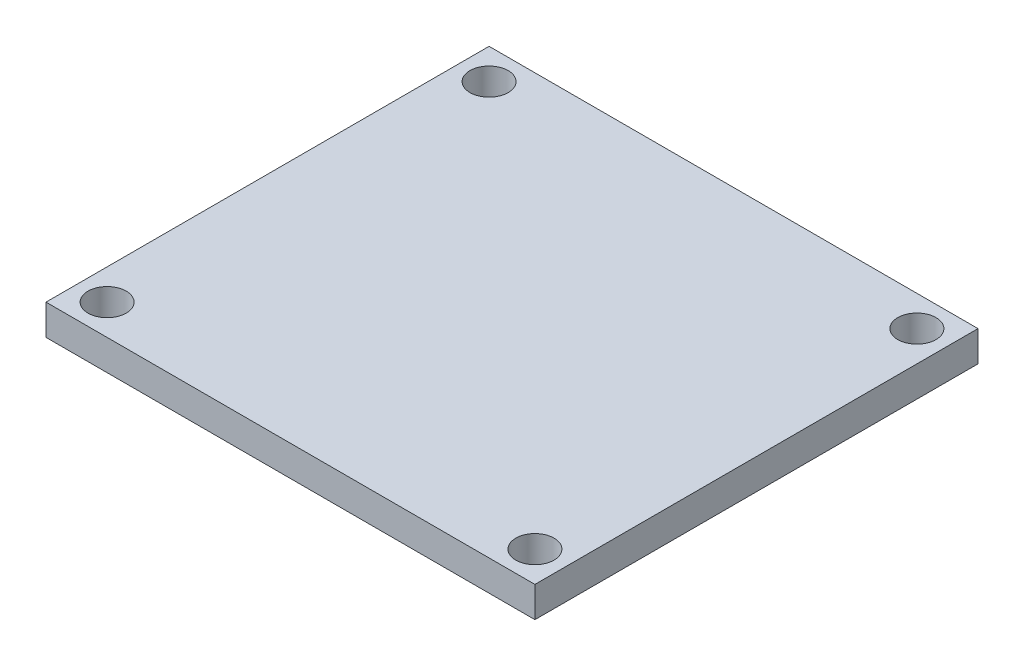
from build123d import *

# Parameters (mm, degrees)
SKETCH1_W           = 40.64
SKETCH1_H           = 36.83
SKETCH1_R           = 1.5875
BOSS_EXTRUDE1_DEPTH = 2.54


with BuildPart() as part:
    # Sketch1 → Boss-Extrude1 (new body)
    with BuildSketch(Plane(origin=(0, 0, 0), x_dir=(1, 0, 0), z_dir=(0, 1, 0))):
        with Locations((20.32, -18.415)):
            Rectangle(SKETCH1_W, SKETCH1_H)
        with Locations(Location((2.54, -2.54, 0), (0, 0, 270))):
            Circle(SKETCH1_R, mode=Mode.SUBTRACT)
        with Locations(Location((2.54, -34.29, 0), (0, 0, 270))):
            Circle(SKETCH1_R, mode=Mode.SUBTRACT)
        with Locations(Location((38.1, -2.54, 0), (0, 0, 270))):
            Circle(SKETCH1_R, mode=Mode.SUBTRACT)
        with Locations(Location((38.1, -34.29, 0), (0, 0, 270))):
            Circle(SKETCH1_R, mode=Mode.SUBTRACT)
    extrude(amount=BOSS_EXTRUDE1_DEPTH)


solid = part.part
